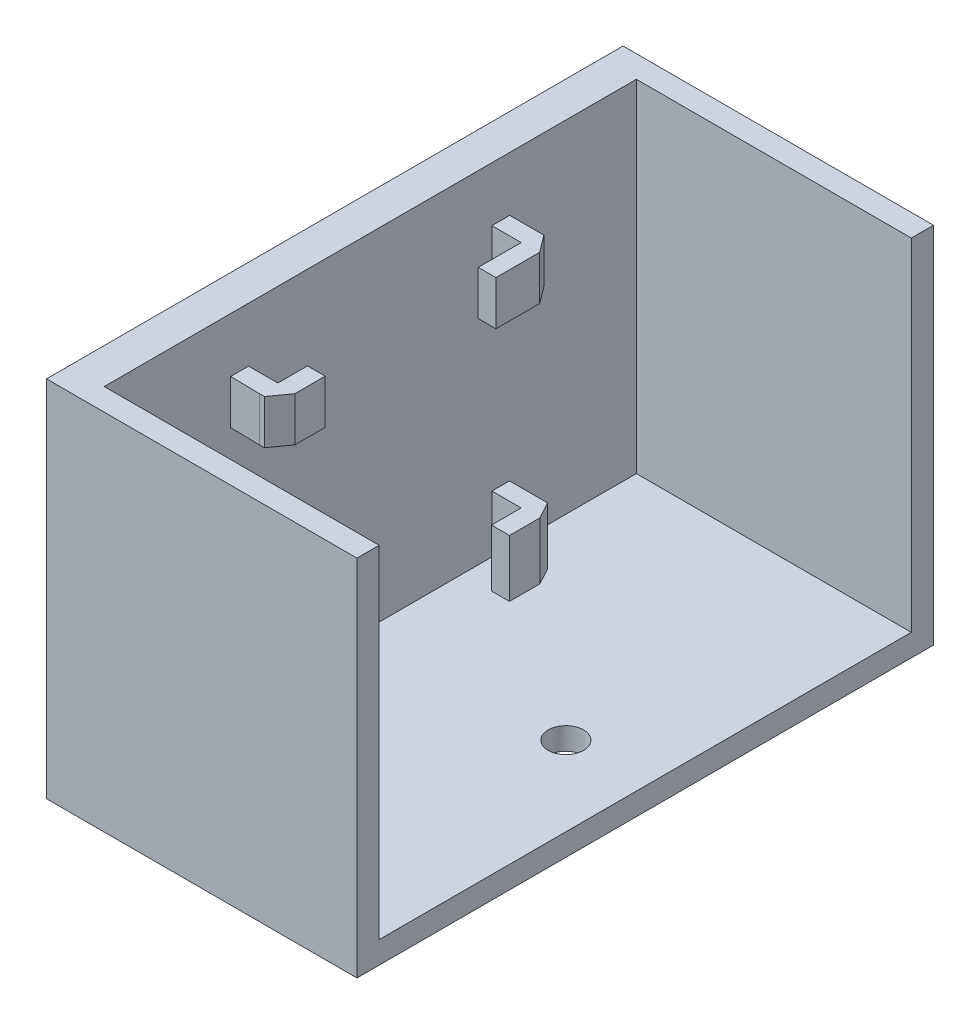
from build123d import *

# Parameters (mm, degrees)
SKETCH1_W           = 35
SKETCH1_H           = 65
BOSS_EXTRUDE1_DEPTH = 2.5
SKETCH2_W           = 4
SKETCH2_H           = 65
BOSS_EXTRUDE2_DEPTH = 38.5
SKETCH3_W           = 31
SKETCH3_H           = 2.5
BOSS_EXTRUDE4_DEPTH = 38.5
BOSS_EXTRUDE6_DEPTH = 11.15
SKETCH15_R          = 2
CUT_EXTRUDE3_DEPTH  = 5
CUT_EXTRUDE6_DEPTH  = 7
BOSS_EXTRUDE7_DEPTH = 6.44


with BuildPart() as part:
    # Sketch1 → Boss-Extrude1 (new body)
    with BuildSketch(Plane(origin=(0, 0, 0), x_dir=(1, 0, 0), z_dir=(0, 1, 0))):
        Rectangle(SKETCH1_W, SKETCH1_H)
    extrude(amount=BOSS_EXTRUDE1_DEPTH)

    # Sketch2 → Boss-Extrude2 (add)
    with BuildSketch(Plane(origin=(0, 2.5, 0), x_dir=(1, 0, 0), z_dir=(0, 1, 0))):
        with Locations((-15.5, 0)):
            Rectangle(SKETCH2_W, SKETCH2_H)
    extrude(amount=BOSS_EXTRUDE2_DEPTH)

    # Sketch3 → Boss-Extrude4 (add)
    with BuildSketch(Plane(origin=(0, 2.5, 0), x_dir=(1, 0, 0), z_dir=(0, 1, 0))):
        with Locations((2, 31.25)):
            Rectangle(SKETCH3_W, SKETCH3_H)
        with Locations((2, -31.25)):
            Rectangle(SKETCH3_W, SKETCH3_H)
    extrude(amount=BOSS_EXTRUDE4_DEPTH)

    # Sketch12 → Boss-Extrude6 (add)
    with BuildSketch(Plane(origin=(0, 41, 0), x_dir=(1, 0, 0), z_dir=(0, 1, 0))):
        Polygon((-8.203844825, -13.796665784), (-9.645047449, -15.79282096), (-10.2, -15.79282096), (-13.5, -15.740186096), (-13.5, -13.717271913), (-10.2, -13.717271913), (-10.2, -10.374022399), (-8.203844825, -10.374022399), align=None)
        Polygon((-13.5, 13.717271913), (-10.2, 13.717271913), (-10.2, 8.874022399), (-8.203844825, 8.874022399), (-8.203844825, 13.796665784), (-9.645047449, 15.721544213), (-13.5, 15.721544213), align=None)
    extrude(amount=-BOSS_EXTRUDE6_DEPTH)

    # Sketch15 → Cut-Extrude3 (cut)
    with BuildSketch(Plane(origin=(0, 2.5, 0), x_dir=(1, 0, 0), z_dir=(0, 1, 0))):
        with Locations(Location((8.550066744, 0, 0), (0, 0, 270))):
            Circle(SKETCH15_R)
    extrude(amount=-CUT_EXTRUDE3_DEPTH, mode=Mode.SUBTRACT)

    # Sketch13 → Cut-Extrude6 (cut)
    with BuildSketch(Plane(origin=(-13.5, 0, 0), x_dir=(0, 0, -1), z_dir=(1, 0, 0))):
        Polygon((-15.719309169, 34.85), (-19.050762409, 34.85), (-19.050762409, 41), (-15.740186096, 41), (21.565915306, 41), (24.332393972, 41), (24.332393972, 34.85), (21.565915306, 34.85), align=None)
    extrude(amount=CUT_EXTRUDE6_DEPTH, mode=Mode.SUBTRACT)

    # Sketch7 → Boss-Extrude7 (add)
    with BuildSketch(Plane(origin=(0, 2.5, 0), x_dir=(1, 0, 0), z_dir=(0, 1, 0))):
        Polygon((-13.5, 13.717271913), (-13.5, 15.696799482), (-9.20372121, 15.696799482), (-8.173305913, 13.796665784), (-8.173305913, 11.874022399), (-8.173305913, 10.367152571), (-10.2, 10.367152571), (-10.2, 13.717271913), align=None)
        Polygon((-13.5, -13.717271913), (-13.5, -15.696799482), (-9.20372121, -15.696799482), (-8.203759602, -13.717271913), (-8.203759602, -10.374022403), (-10.2, -10.374022403), (-10.2, -13.717271913), align=None)
    extrude(amount=BOSS_EXTRUDE7_DEPTH)


solid = part.part
